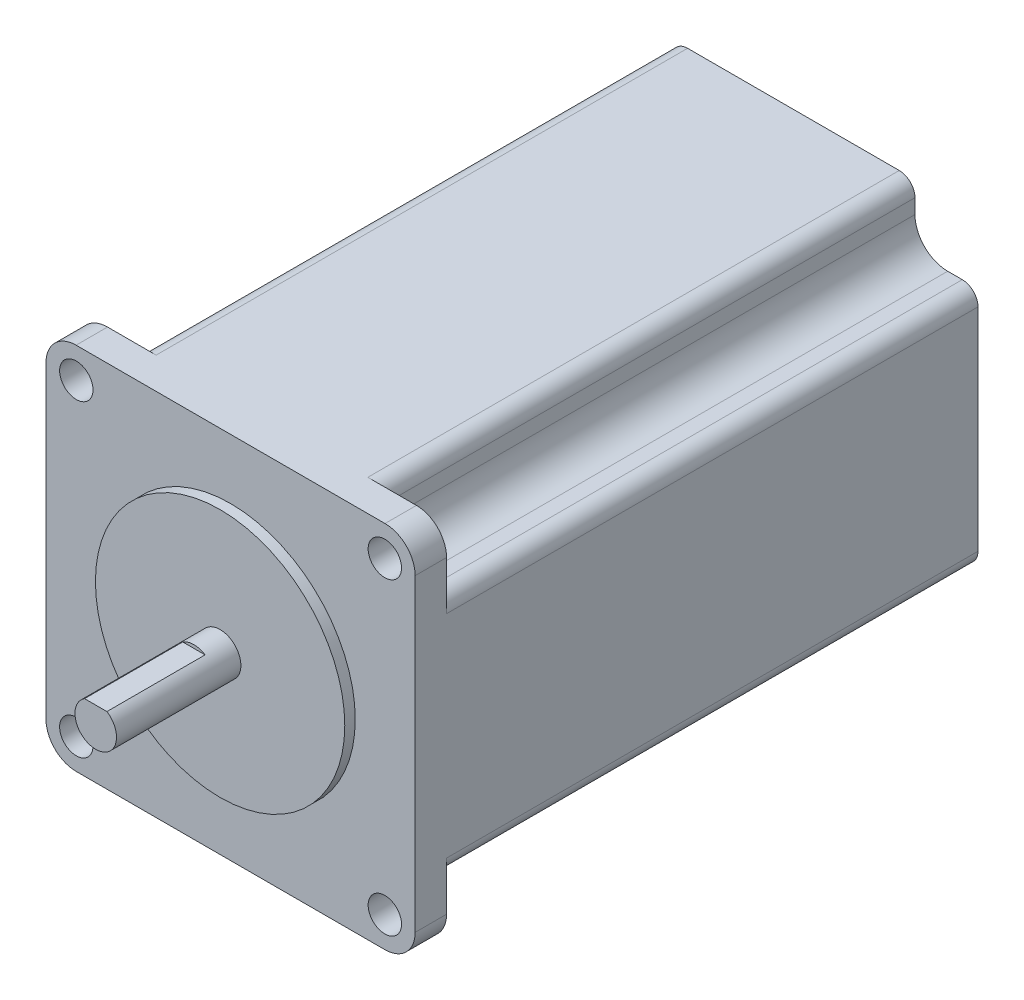
from build123d import *

# Parameters (mm, degrees)
SKETCH1_W                  = 56.4
SKETCH1_H                  = 56.4
BOSS_EXTRUDE1_DEPTH        = 86
SKETCH2_W                  = 9.63
SKETCH2_H                  = 9.63
CUT_EXTRUDE1_DEPTH         = 81.2
FILLET1_R                  = 5
FILLET2_R                  = 2.4
FILLET3_R                  = 4.6
F_5_1_5_1_DIAMETER_HOLE1_D = 5.1
CIRPATTERN1_COUNT          = 4
SKETCH7_R                  = 19.05
BOSS_EXTRUDE2_DEPTH        = 1.6
SKETCH8_R                  = 3.175
BOSS_EXTRUDE3_DEPTH        = 19
CUT_EXTRUDE2_START         = -15
CUT_EXTRUDE2_DEPTH         = 15
SKETCH11_W                 = 32.34
SKETCH11_H                 = 20
BOSS_EXTRUDE4_DEPTH        = 0.2


with BuildPart() as part:
    # Sketch1 → Boss-Extrude1 (new body)
    with BuildSketch(Plane.XY):
        Rectangle(SKETCH1_W, SKETCH1_H)
    extrude(amount=-BOSS_EXTRUDE1_DEPTH)

    # Sketch2 → Cut-Extrude1 (cut)
    with BuildSketch(Plane(origin=(0, 0, -86), x_dir=(-1, 0, 0), z_dir=(0, 0, -1))):
        with Locations((23.385, 23.385)):
            Rectangle(SKETCH2_W, SKETCH2_H)
        with Locations((-23.385, 23.385)):
            Rectangle(SKETCH2_W, SKETCH2_H)
        with Locations((23.385, -23.385)):
            Rectangle(SKETCH2_W, SKETCH2_H)
        with Locations((-23.385, -23.385)):
            Rectangle(SKETCH2_W, SKETCH2_H)
    extrude(amount=-CUT_EXTRUDE1_DEPTH, mode=Mode.SUBTRACT)

    # Fillet1
    fillet1_edges = [part.edges().sort_by_distance(p)[0] for p in [
        (18.57, -18.57, -45.4),
        (-18.57, -18.57, -45.4),
        (-18.57, 18.57, -45.4),
        (18.57, 18.57, -45.4),
    ]]
    fillet(fillet1_edges, radius=FILLET1_R)

    # Fillet2
    fillet2_edges = [part.edges().sort_by_distance(p)[0] for p in [
        (18.57, -28.2, -45.4),
        (28.2, -18.57, -45.4),
        (-28.2, -18.57, -45.4),
        (-18.57, -28.2, -45.4),
        (-18.57, 28.2, -45.4),
        (-28.2, 18.57, -45.4),
        (28.2, 18.57, -45.4),
        (18.57, 28.2, -45.4),
    ]]
    fillet(fillet2_edges, radius=FILLET2_R)

    # Fillet3
    fillet3_edges = [part.edges().sort_by_distance(p)[0] for p in [
        (28.2, 28.2, -2.4),
        (-28.2, 28.2, -2.4),
        (-28.2, -28.2, -2.4),
        (28.2, -28.2, -2.4),
    ]]
    fillet(fillet3_edges, radius=FILLET3_R)

    # Ø5.1 (5.1) Diameter Hole1 (through all)
    with Locations(Plane.XY):
        with Locations((-23.57, 23.57)):
            f_5_1_5_1_diameter_hole1 = Hole(F_5_1_5_1_DIAMETER_HOLE1_D / 2)

    # CirPattern1: Ø5.1 (5.1) Diameter Hole1 ×4 about axis
    cirpattern1_axis = Axis((0, 0, 0), (0, 0, 1))
    for i in range(1, CIRPATTERN1_COUNT):
        add(f_5_1_5_1_diameter_hole1.rotate(cirpattern1_axis, i * 360 / CIRPATTERN1_COUNT), mode=Mode.SUBTRACT)

    # Sketch7 → Boss-Extrude2 (add)
    with BuildSketch(Plane.XY):
        Circle(SKETCH7_R)
    extrude(amount=BOSS_EXTRUDE2_DEPTH)

    # Sketch8 → Boss-Extrude3 (add)
    with BuildSketch(Plane.XY.offset(1.6)):
        Circle(SKETCH8_R)
    extrude(amount=BOSS_EXTRUDE3_DEPTH)

    # Sketch9 → Cut-Extrude2 (cut)
    with BuildSketch(Plane.XY.offset(20.6).offset(CUT_EXTRUDE2_START)):
        with BuildLine():
            Line((-1.71, 2.675168219), (1.71, 2.675168219))
            ThreePointArc((1.71, 2.675168219), (0, 3.175), (-1.71, 2.675168219))
        make_face()
    extrude(amount=CUT_EXTRUDE2_DEPTH, mode=Mode.SUBTRACT)

    # Sketch11 → Boss-Extrude4 (add)
    with BuildSketch(Plane.XZ.offset(28.2)):
        with Locations((0, -76)):
            Rectangle(SKETCH11_W, SKETCH11_H)
        with Locations((0, -14.8)):
            Rectangle(SKETCH11_W, SKETCH11_H)
    extrude(amount=BOSS_EXTRUDE4_DEPTH)


solid = part.part
